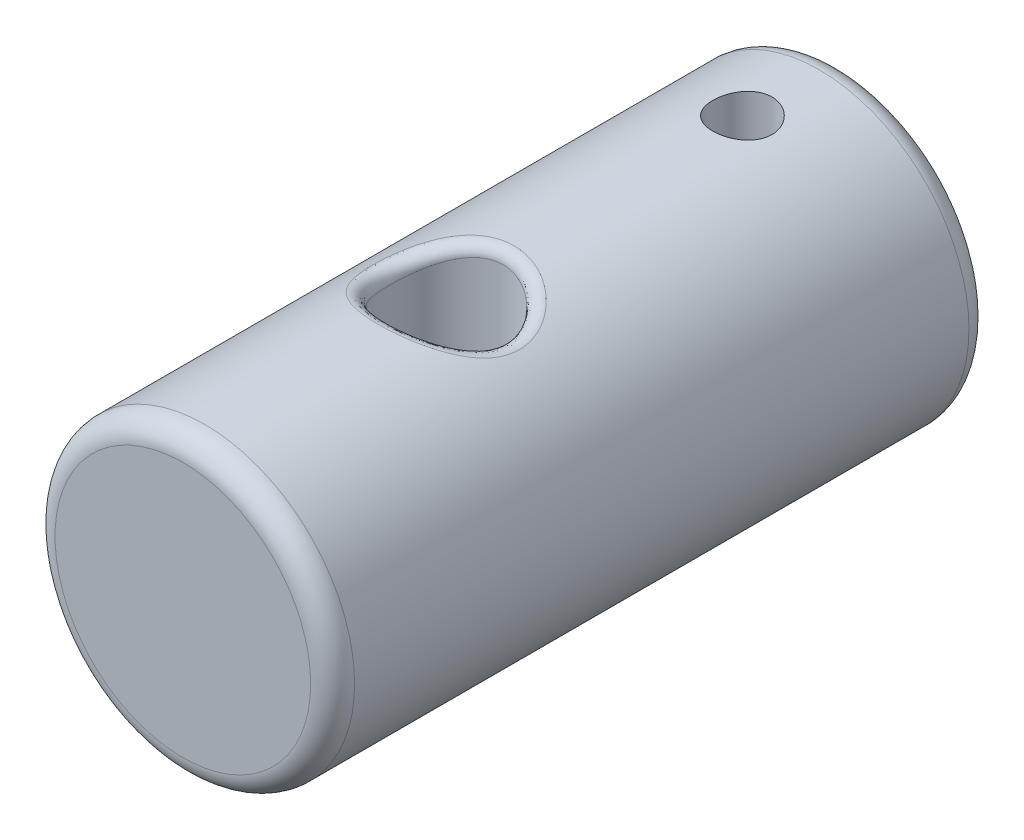
from build123d import *

# Parameters (mm, degrees)
BOSS_EXTRUDE1_DEPTH      = 12
BOSS_EXTRUDE1_DEPTH_BACK = 18
SKETCH1_R                = 6.825
CUT_EXTRUDE1_DEPTH       = 21.424525698
CUT_EXTRUDE1_DEPTH_BACK  = 21.424525698
SKETCH2_R                = 2.6
SKETCH2_R_2              = 1.35
FILLET1_R                = 1
FILLET2_R                = 0.5


with BuildPart() as part:
    # Sketch1 → Boss-Extrude1 (new, two sides: drawn at the far end of the back side and taken through both)
    with BuildSketch(Plane.XY.offset(-BOSS_EXTRUDE1_DEPTH_BACK)):
        Circle(SKETCH1_R)
    extrude(amount=BOSS_EXTRUDE1_DEPTH + BOSS_EXTRUDE1_DEPTH_BACK)

    # Sketch2 → Cut-Extrude1 (cut, two sides: drawn at the far end of the back side and taken through both)
    with BuildSketch(Plane(origin=(0, 0, 0), x_dir=(1, 0, 0), z_dir=(0, 1, 0)).offset(-CUT_EXTRUDE1_DEPTH_BACK)):
        with Locations(Location((0, 0, 0), (0, 0, 270))):
            Circle(SKETCH2_R)
        with Locations(Location((0, 13.5, 0), (0, 0, 270))):
            Circle(SKETCH2_R_2)
    extrude(amount=CUT_EXTRUDE1_DEPTH + CUT_EXTRUDE1_DEPTH_BACK, mode=Mode.SUBTRACT)

    # Fillet1
    fillet1_edges = [part.edges().sort_by_distance(p)[0] for p in [
        (-6.825, 0, 12),
        (-6.825, 0, -18),
    ]]
    fillet(fillet1_edges, radius=FILLET1_R)

    # Fillet2
    fillet2_edges = [part.edges().sort_by_distance(p)[0] for p in [
        (1e-09, 6.825, -2.600000001),
        (0, -6.825, -2.600000002),
    ]]
    fillet(fillet2_edges, radius=FILLET2_R)


solid = part.part
